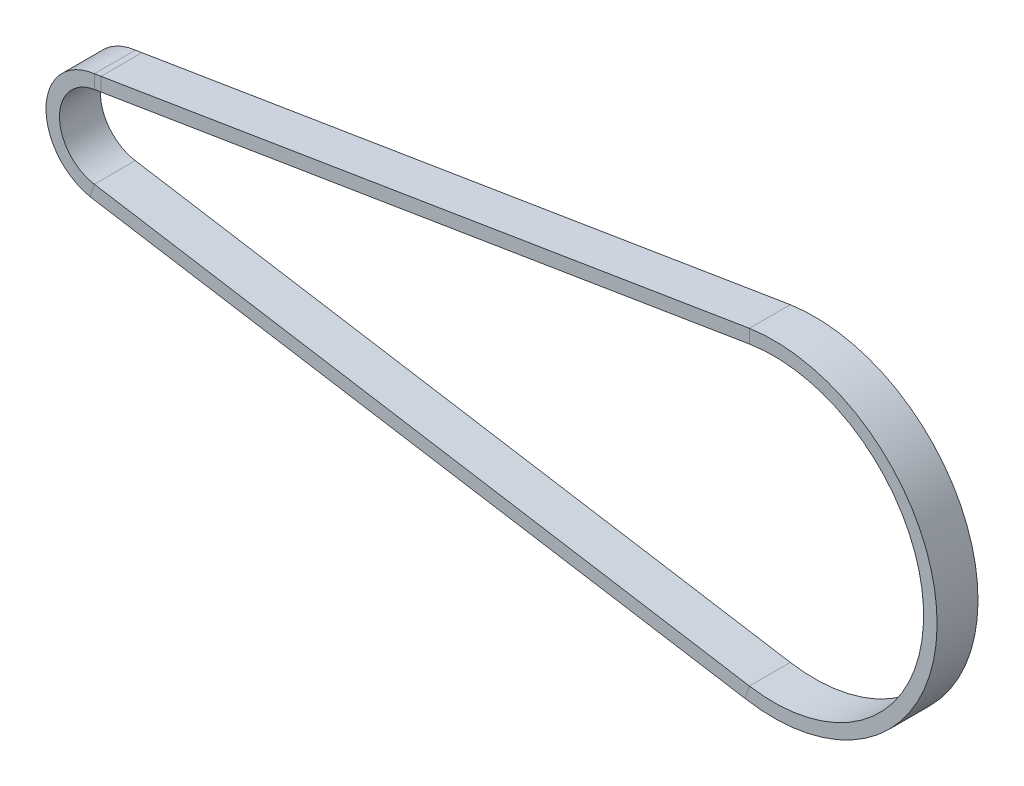
from build123d import *

# Parameters (mm, degrees)
SKETCH3_W = 19.05
SKETCH3_H = 6.35


with BuildPart() as part:
    # Sweep1: sweep along a path in Sketch2
    with BuildLine(Plane.XY) as sweep1_path:
        Line((-3.122423531, 19.106672138), (301.7895107, 68.935558682))
        ThreePointArc((301.7895107, 68.935558682), (382.905, 0), (301.7895107, -68.935558682))
        Line((301.7895107, -68.935558682), (-3.122423531, -19.106672138))
        ThreePointArc((-3.122423531, -19.106672138), (-19.360125229, 0), (-3.122423531, 19.106672138))
    # Sketch3 → Sweep1 (sweep)
    with BuildSketch(Plane(origin=(0, 0, 0), x_dir=(0, 0, -1), z_dir=(1, 0, 0))):
        with Locations((0, 22.791940417)):
            Rectangle(SKETCH3_W, SKETCH3_H)
    sweep(path=sweep1_path.line)


solid = part.part
